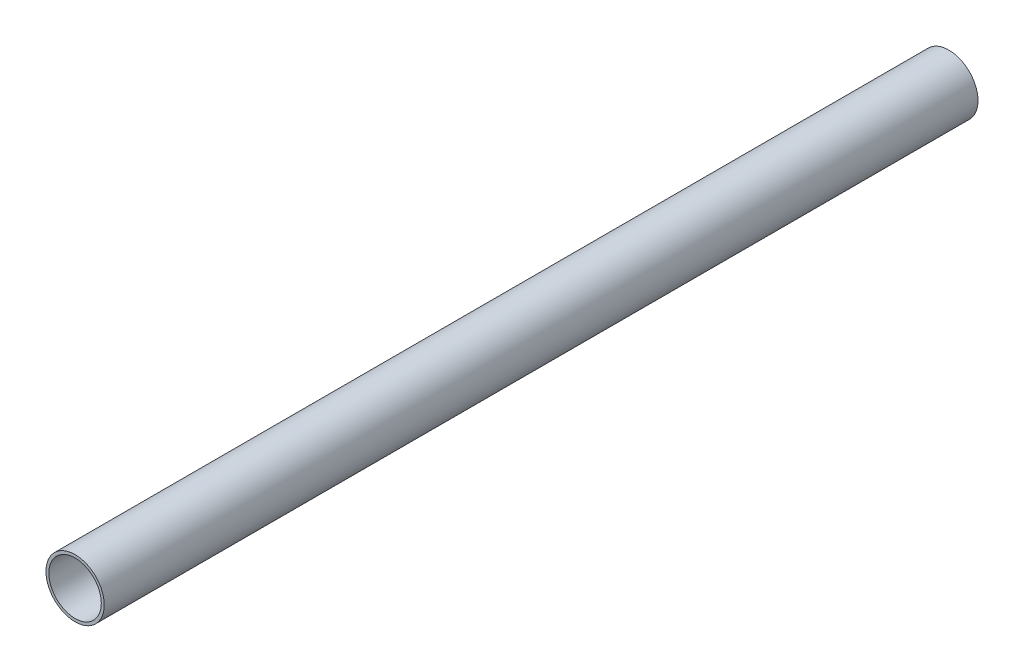
from build123d import *

# Parameters (mm, degrees)
SKETCH1_R           = 10
SKETCH1_R_2         = 9
BOSS_EXTRUDE1_DEPTH = 300


with BuildPart() as part:
    # Sketch1 → Boss-Extrude1 (new body)
    with BuildSketch(Plane.XY):
        Circle(SKETCH1_R)
        Circle(SKETCH1_R_2, mode=Mode.SUBTRACT)
    extrude(amount=BOSS_EXTRUDE1_DEPTH)


solid = part.part
